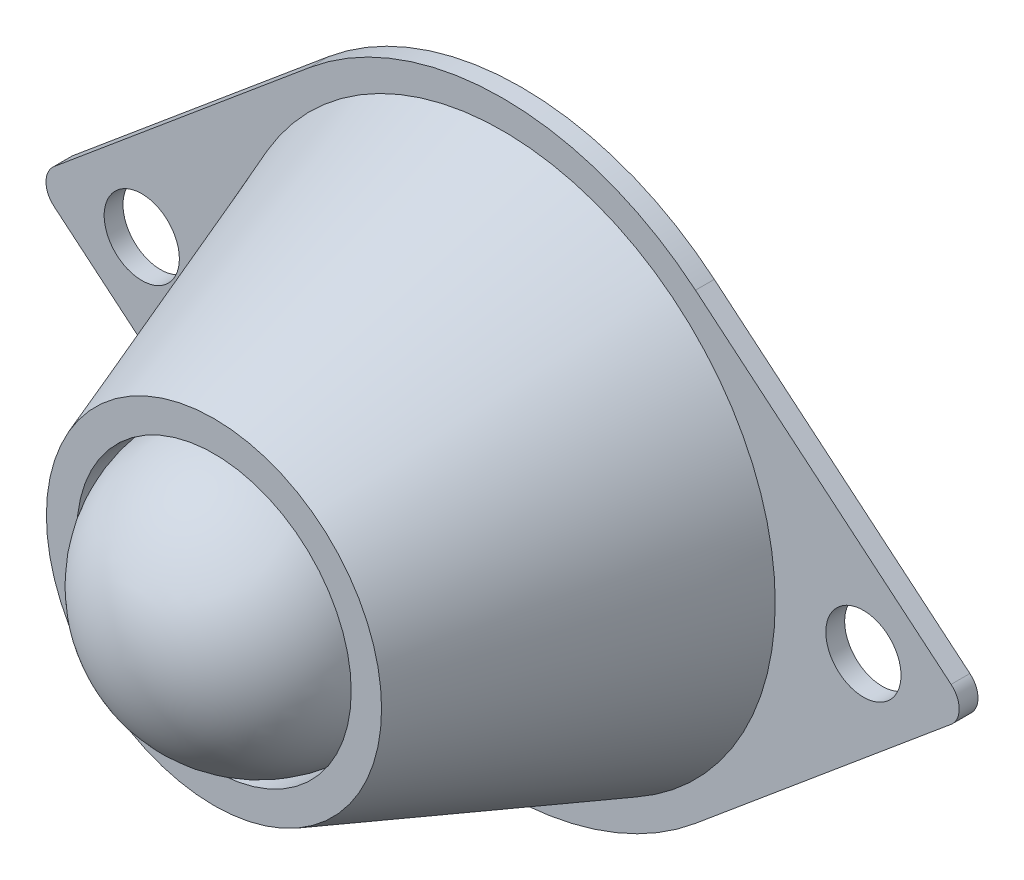
from build123d import *

# Parameters (mm, degrees)
SKETCH1_R           = 2
BOSS_EXTRUDE1_DEPTH = 1
SKETCH2_R           = 14.5
BOSS_EXTRUDE7_DEPTH = 15.35
BOSS_EXTRUDE7_TAPER = 20
SKETCH5_R           = 7.3
CUT_EXTRUDE1_DEPTH  = 2.4


with BuildPart() as part:
    # Sketch1 → Boss-Extrude1 (new body)
    with BuildSketch(Plane.XY):
        with BuildLine():
            Line((-23.852790838, 0.920895504), (-10.258451011, 12.278606715))
            ThreePointArc((-10.258451011, 12.278606715), (0, 16), (10.258451011, 12.278606715))
            Line((10.258451011, 12.278606715), (23.852790838, 0.920895504))
            ThreePointArc((23.852790838, 0.920895504), (24.283407012, 0), (23.852790838, -0.920895504))
            Line((23.852790838, -0.920895504), (10.258451011, -12.278606715))
            ThreePointArc((10.258451011, -12.278606715), (0, -16), (-10.258451011, -12.278606715))
            Line((-10.258451011, -12.278606715), (-23.852790838, -0.920895504))
            ThreePointArc((-23.852790838, -0.920895504), (-24.283407012, 0), (-23.852790838, 0.920895504))
        make_face()
        with Locations((-19.19, 0)):
            Circle(SKETCH1_R, mode=Mode.SUBTRACT)
        with Locations(Location((19.19, 0, 0), (0, 0, 180))):
            Circle(SKETCH1_R, mode=Mode.SUBTRACT)
    extrude(amount=BOSS_EXTRUDE1_DEPTH)

    # Sketch2 → Boss-Extrude7 (add)
    with BuildSketch(Plane.XY.offset(1)):
        Circle(SKETCH2_R)
    extrude(amount=BOSS_EXTRUDE7_DEPTH, taper=BOSS_EXTRUDE7_TAPER)

    # Sketch5 → Cut-Extrude1 (cut)
    with BuildSketch(Plane.XY.offset(16.35)):
        Circle(SKETCH5_R)
    extrude(amount=-CUT_EXTRUDE1_DEPTH, mode=Mode.SUBTRACT)

    # Sketch6 → Revolve3 (revolve)
    with BuildSketch(Plane.XY.offset(13.95)):
        with BuildLine():
            Line((0, -7.3), (0, 7.3))
            ThreePointArc((0, 7.3), (-7.3, 0), (0, -7.3))
        make_face()
    revolve(axis=Axis((0, -7.3, 13.95), (0, 1, 0)))


solid = part.part
